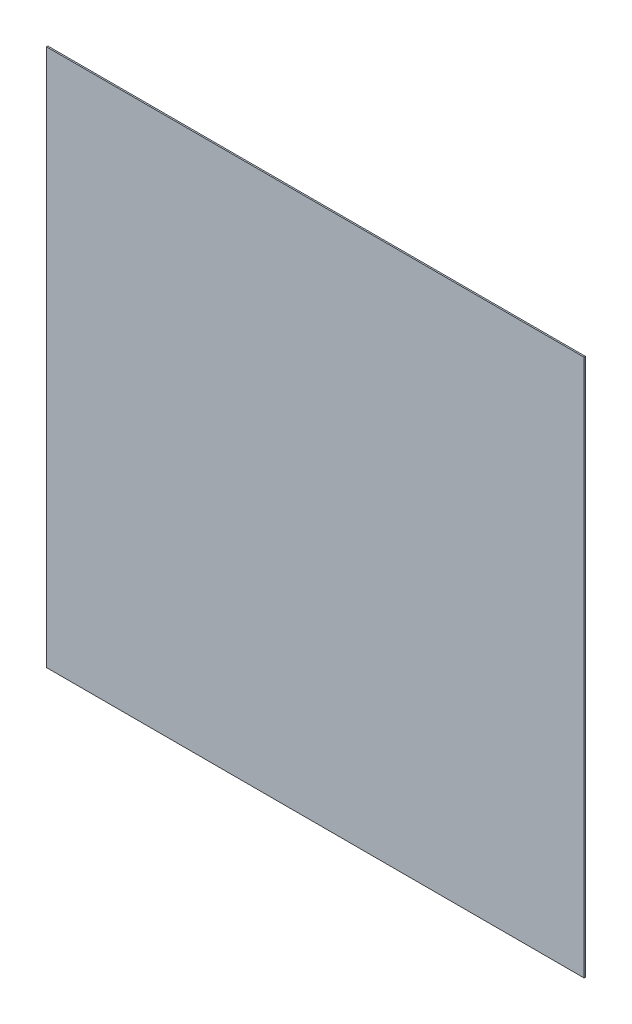
from build123d import *

# Parameters (mm, degrees)
SKETCH1_W           = 1219.2
SKETCH1_H           = 1219.2
BOSS_EXTRUDE1_DEPTH = 3.175


with BuildPart() as part:
    # Sketch1 → Boss-Extrude1 (new body)
    with BuildSketch(Plane.XY):
        Rectangle(SKETCH1_W, SKETCH1_H)
    extrude(amount=BOSS_EXTRUDE1_DEPTH)


solid = part.part
